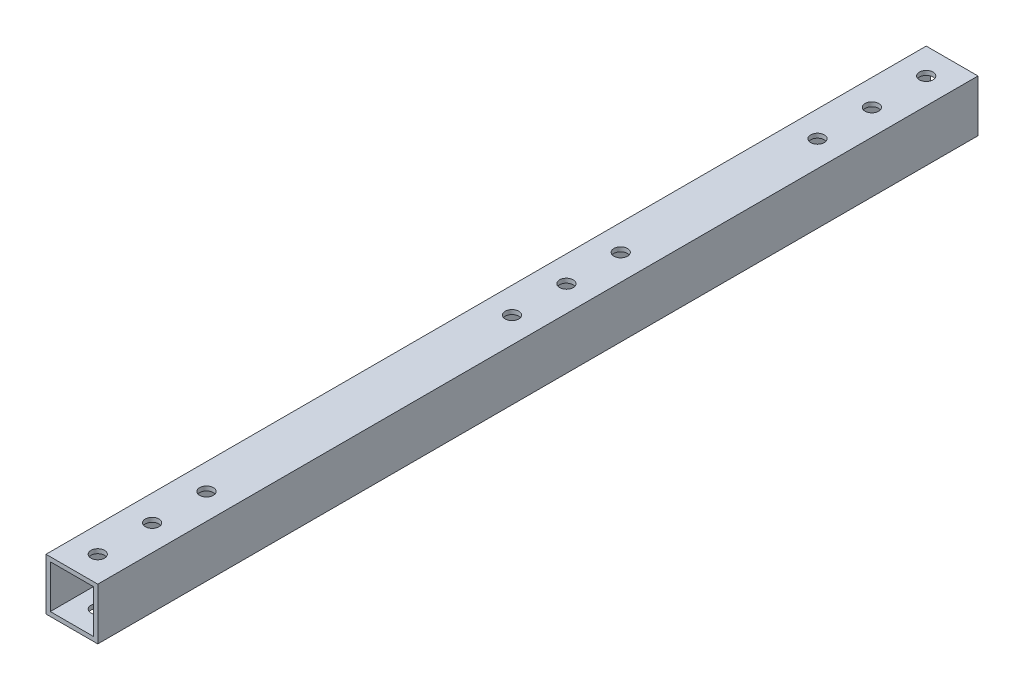
from build123d import *

# Parameters (mm, degrees)
SKETCH1_W           = 19.05
SKETCH1_H           = 19.05
SKETCH1_W_2         = 15.875
SKETCH1_H_2         = 15.875
BOSS_EXTRUDE1_DEPTH = 161.925
SKETCH2_R           = 2.5
CUT_EXTRUDE1_DEPTH  = 30
SKETCH3_R           = 2.5
CUT_EXTRUDE2_DEPTH  = 30


with BuildPart() as part:
    # Sketch1 → Boss-Extrude1 (new, symmetric)
    with BuildSketch(Plane.XY):
        Rectangle(SKETCH1_W, SKETCH1_H)
        Rectangle(SKETCH1_W_2, SKETCH1_H_2, mode=Mode.SUBTRACT)
    extrude(amount=BOSS_EXTRUDE1_DEPTH, both=True)

    # Sketch2 → Cut-Extrude1 (cut)
    with BuildSketch(Plane(origin=(-206.375, 13.525, 0), x_dir=(0, 0, -1), z_dir=(0, 1, 0))):
        with Locations(Location((152.4, -206.375, 0), (0, 0, 180))):
            Circle(SKETCH2_R)
        with Locations(Location((132.4, -206.375, 0), (0, 0, 180))):
            Circle(SKETCH2_R)
        with Locations(Location((112.4, -206.375, 0), (0, 0, 180))):
            Circle(SKETCH2_R)
    cut_extrude1 = extrude(amount=-CUT_EXTRUDE1_DEPTH, mode=Mode.SUBTRACT)

    # Mirror1: Cut-Extrude1 across Front Plane
    add(cut_extrude1.mirror(Plane.XY), mode=Mode.SUBTRACT)

    # Sketch3 → Cut-Extrude2 (cut)
    with BuildSketch(Plane(origin=(-206.375, 13.525, 0), x_dir=(0, 0, -1), z_dir=(0, 1, 0))):
        with Locations(Location((0, -206.375, 0), (0, 0, 180))):
            Circle(SKETCH3_R)
        with Locations(Location((20, -206.375, 0), (0, 0, 180))):
            Circle(SKETCH3_R)
        with Locations(Location((40, -206.375, 0), (0, 0, 180))):
            Circle(SKETCH3_R)
    extrude(amount=-CUT_EXTRUDE2_DEPTH, mode=Mode.SUBTRACT)


solid = part.part
